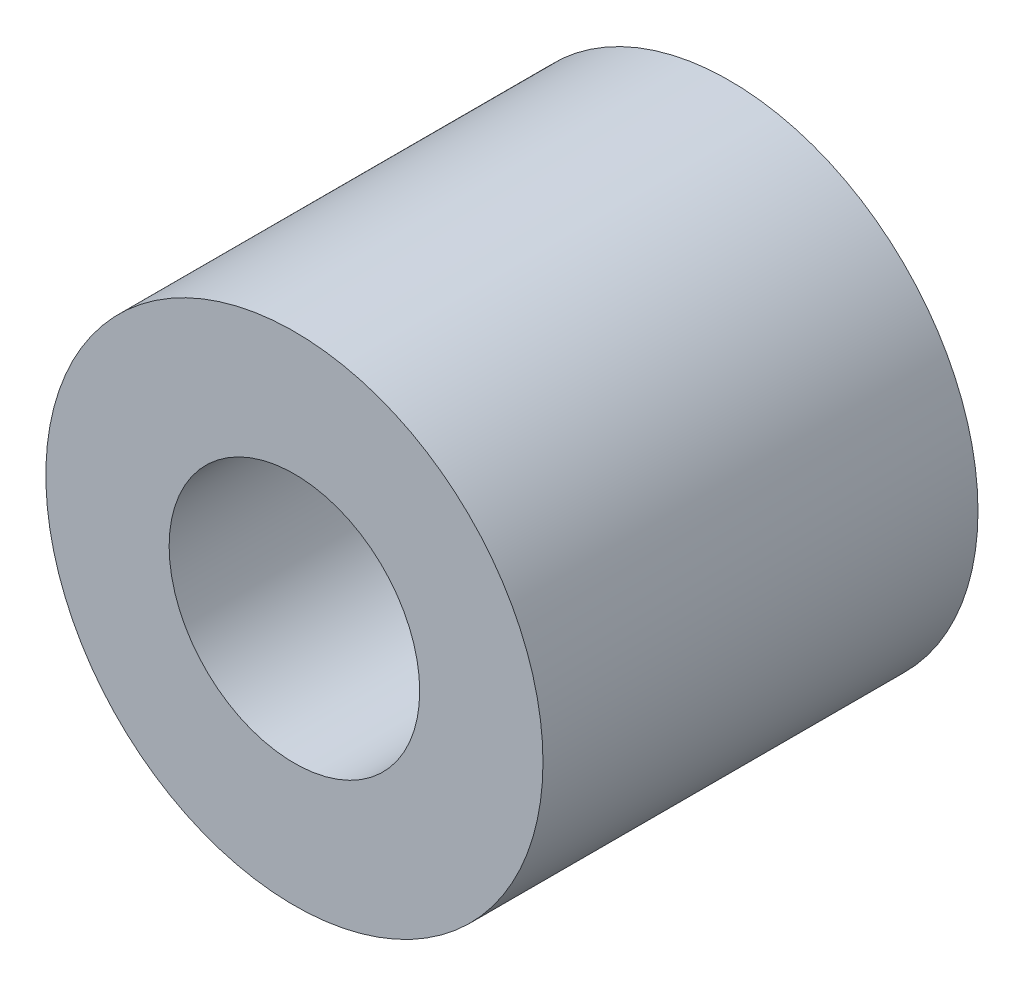
from build123d import *

# Parameters (mm, degrees)
SKETCH1_R      = 6.35
SKETCH1_R_2    = 3.2004
EXTRUDE1_DEPTH = 5.55625


with BuildPart() as part:
    # Sketch1 → Extrude1 (new, symmetric)
    with BuildSketch(Plane.XY):
        Circle(SKETCH1_R)
        Circle(SKETCH1_R_2, mode=Mode.SUBTRACT)
    extrude(amount=EXTRUDE1_DEPTH, both=True)


solid = part.part
